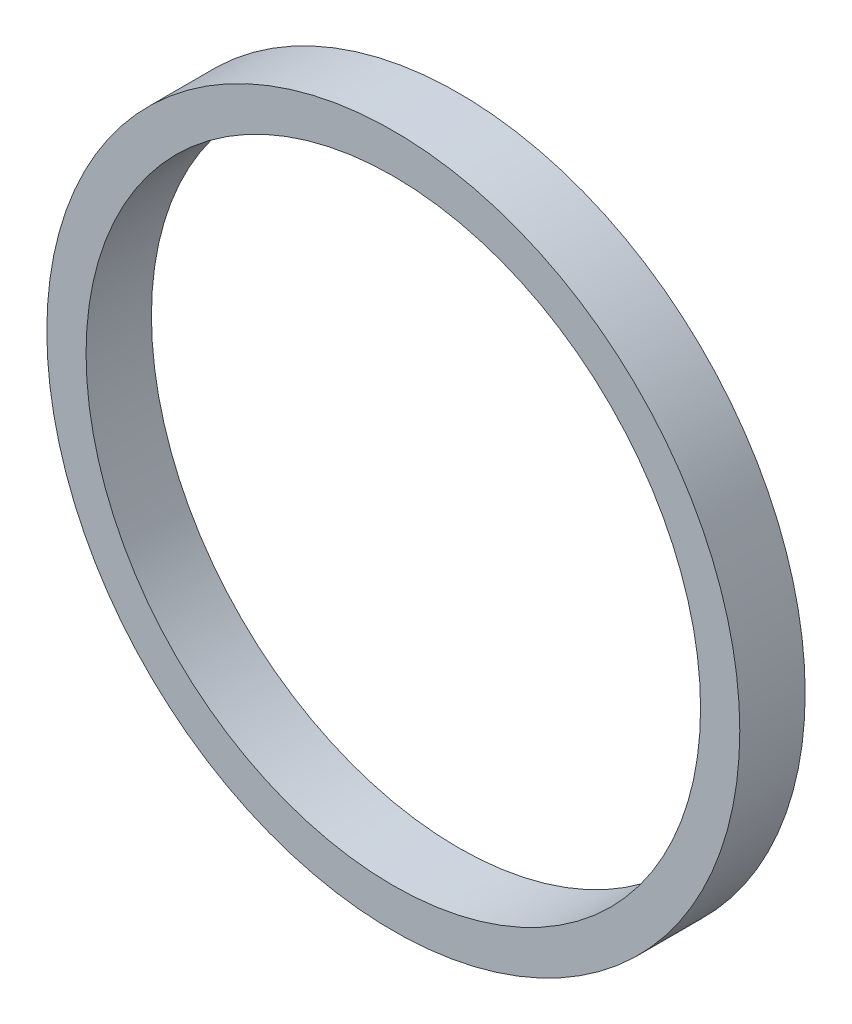
from build123d import *

# Parameters (mm, degrees)
SKETCH2_R           = 15.9
SKETCH2_R_2         = 14.1
EXTRUDE_THIN1_DEPTH = 3


with BuildPart() as part:
    # Sketch2 → Extrude-Thin1 (new body)
    with BuildSketch(Plane.XY):
        Circle(SKETCH2_R)
        Circle(SKETCH2_R_2, mode=Mode.SUBTRACT)
    extrude(amount=EXTRUDE_THIN1_DEPTH)


solid = part.part
